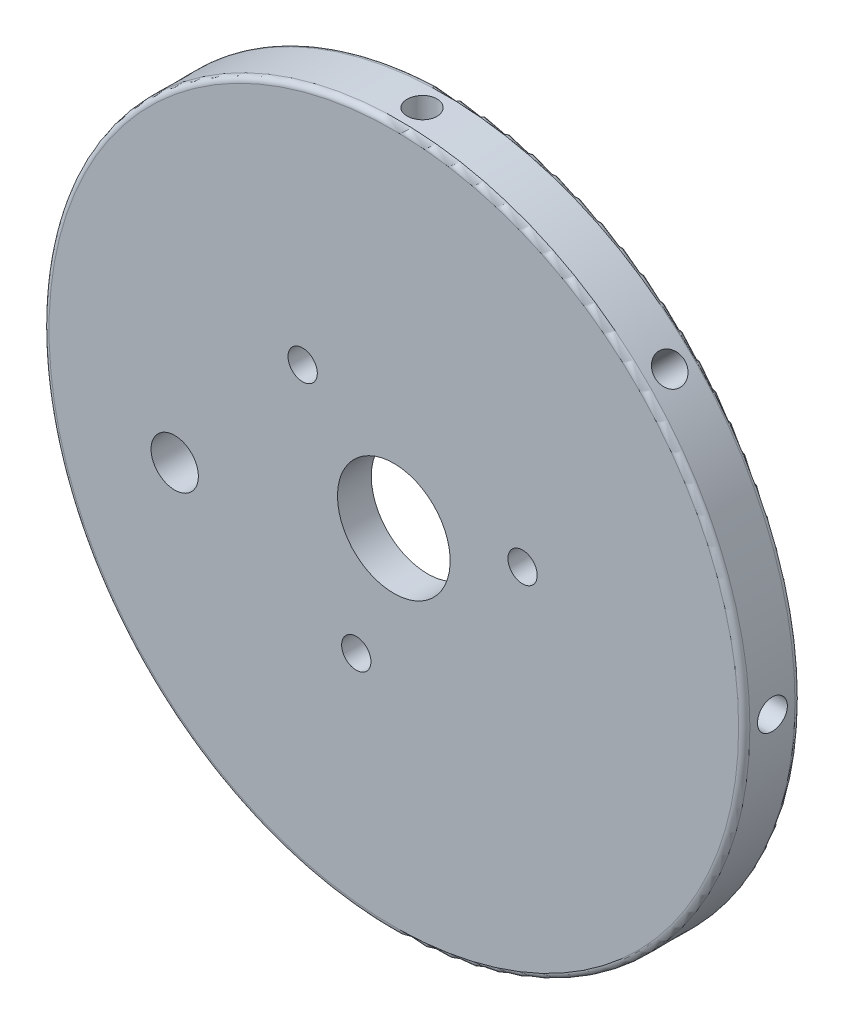
from build123d import *

# Parameters (mm, degrees)
IZIM1_R                     = 62.2
Y_KSEKLIK_EKSTR_ZYON1_DEPTH = 10
RADYUS1_R                   = 1
IZIM2_R                     = 10
KES_EKSTR_ZYON1_DEPTH       = 10
IZIM8_R                     = 2.6
KES_EKSTR_ZYON5_DEPTH       = 10
IZIM10_R                    = 29
KES_EKSTR_ZYON7_DEPTH       = 4
M8_BO_LUKLU_DELIK1_D        = 8.4
DAIRESEL_KAPLAMA1_COUNT     = 8


with BuildPart() as part:
    # Çizim1 → Yükseklik-Ekstrüzyon1 (new body)
    with BuildSketch(Plane.XY):
        Circle(IZIM1_R)
    extrude(amount=Y_KSEKLIK_EKSTR_ZYON1_DEPTH)

    # Radyus1
    radyus1_edges = [part.edges().sort_by_distance(p)[0] for p in [
        (-62.2, 0, 0),
        (-62.2, 0, 10),
    ]]
    fillet(radyus1_edges, radius=RADYUS1_R)

    # Çizim2 → Kes-Ekstrüzyon1 (cut)
    with BuildSketch(Plane(origin=(0, 0, 0), x_dir=(-1, 0, 0), z_dir=(0, 0, -1))):
        Circle(IZIM2_R)
    extrude(amount=-KES_EKSTR_ZYON1_DEPTH, mode=Mode.SUBTRACT)

    # Çizim8 → Kes-Ekstrüzyon5 (cut)
    with BuildSketch(Plane(origin=(0, 0, 0), x_dir=(-1, 0, 0), z_dir=(0, 0, -1))):
        with Locations((16.183768006, 17.039238631)):
            Circle(IZIM8_R)
        with Locations((6.664529512, -22.535173538)):
            Circle(IZIM8_R)
        with Locations((-22.848297519, 5.495934907)):
            Circle(IZIM8_R)
    extrude(amount=-KES_EKSTR_ZYON5_DEPTH, mode=Mode.SUBTRACT)

    # Çizim10 → Kes-Ekstrüzyon7 (cut)
    with BuildSketch(Plane(origin=(0, 0, 0), x_dir=(-1, 0, 0), z_dir=(0, 0, -1))):
        Circle(IZIM10_R)
    extrude(amount=-KES_EKSTR_ZYON7_DEPTH, mode=Mode.SUBTRACT)

    # M8 Boşluklu Delik1 (through all)
    with Locations(Plane(origin=(-38.890719181, -9.35478282, 10), x_dir=(1, 0, 0), z_dir=(0, 0, 1))):
        with Locations((0, 0)):
            Hole(M8_BO_LUKLU_DELIK1_D / 2)

    # Çizim18 → M5 Boşluklu Delik1 (revolve, cut)
    with BuildSketch(Plane(origin=(0, 62.2, 5), x_dir=(0, 0, 1), z_dir=(1, 0, 0))):
        Polygon((0, 0), (0, 14.19228064), (2.65, 12.6), (2.65, 0), align=None)
    m5_bo_luklu_delik1 = revolve(axis=Axis((0, 68.55, 5), (0, -1, 0)), mode=Mode.SUBTRACT)

    # Dairesel Kaplama1: M5 Boşluklu Delik1 ×8 about axis
    dairesel_kaplama1_axis = Axis((0, 0, 10), (0, 0, -1))
    for i in range(1, DAIRESEL_KAPLAMA1_COUNT):
        add(m5_bo_luklu_delik1.rotate(dairesel_kaplama1_axis, i * 360 / DAIRESEL_KAPLAMA1_COUNT), mode=Mode.SUBTRACT)


solid = part.part
